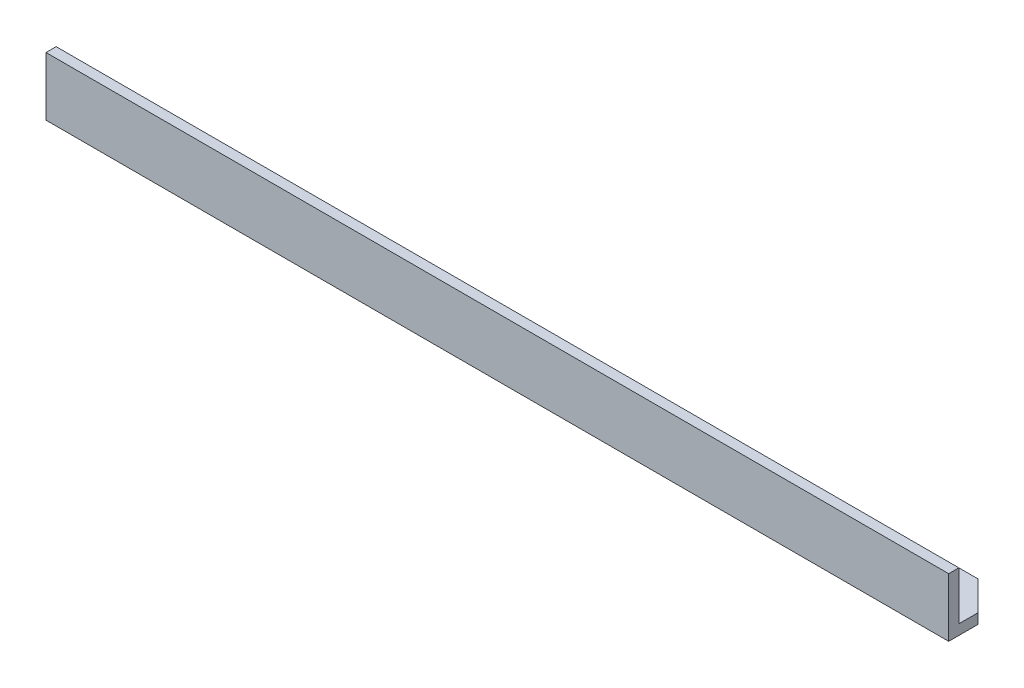
from build123d import *

# Parameters (mm, degrees)
BOSS_EXTRUDE1_DEPTH = 308
SKETCH2_R           = 3
CUT_EXTRUDE1_DEPTH  = 310.295974756


with BuildPart() as part:
    # Sketch1 → Boss-Extrude1 (new body)
    with BuildSketch(Plane(origin=(0, 0, 0), x_dir=(0, 0, -1), z_dir=(1, 0, 0))):
        Polygon((0, 0), (20, 0), (20, 3.461178467), (3.461178467, 3.461178467), (3.461178467, 20), (0, 20), align=None)
    extrude(amount=BOSS_EXTRUDE1_DEPTH)

    # Sketch2 → Cut-Extrude1 (cut, through all)
    with BuildSketch(Plane(origin=(0, 0, 0), x_dir=(1, 0, 0), z_dir=(0, 1, 0))):
        with Locations(Location((278, 15.25, 0), (0, 0, 90))):
            Circle(SKETCH2_R)
        Polygon((308, 10), (298, 20), (308, 20), align=None)
        Polygon((0, 20), (5, 20), (0, 15), align=None)
    extrude(amount=CUT_EXTRUDE1_DEPTH, mode=Mode.SUBTRACT)


solid = part.part
